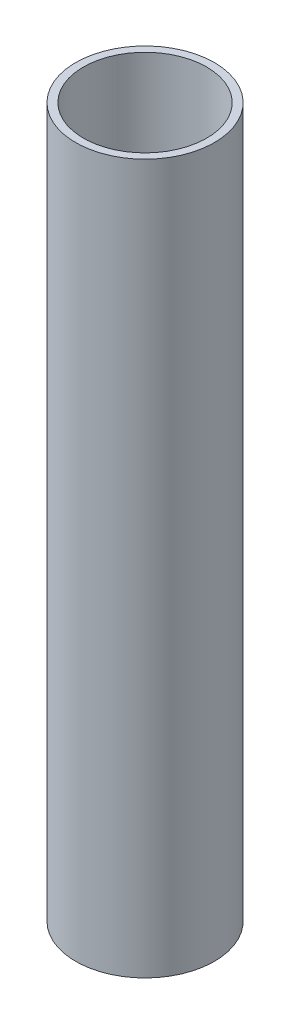
from build123d import *

# Parameters (mm, degrees)
SKETCH2_R           = 22.86
SKETCH2_R_2         = 20.32
BOSS_EXTRUDE1_DEPTH = 233.68


with BuildPart() as part:
    # Sketch2 → Boss-Extrude1 (new body)
    with BuildSketch(Plane(origin=(0, 0, 0), x_dir=(1, 0, 0), z_dir=(0, 1, 0))):
        with Locations(Location((0, 0, 0), (0, 0, 90))):
            Circle(SKETCH2_R)
        with Locations(Location((0, 0, 0), (0, 0, 90))):
            Circle(SKETCH2_R_2, mode=Mode.SUBTRACT)
    extrude(amount=BOSS_EXTRUDE1_DEPTH)


solid = part.part
